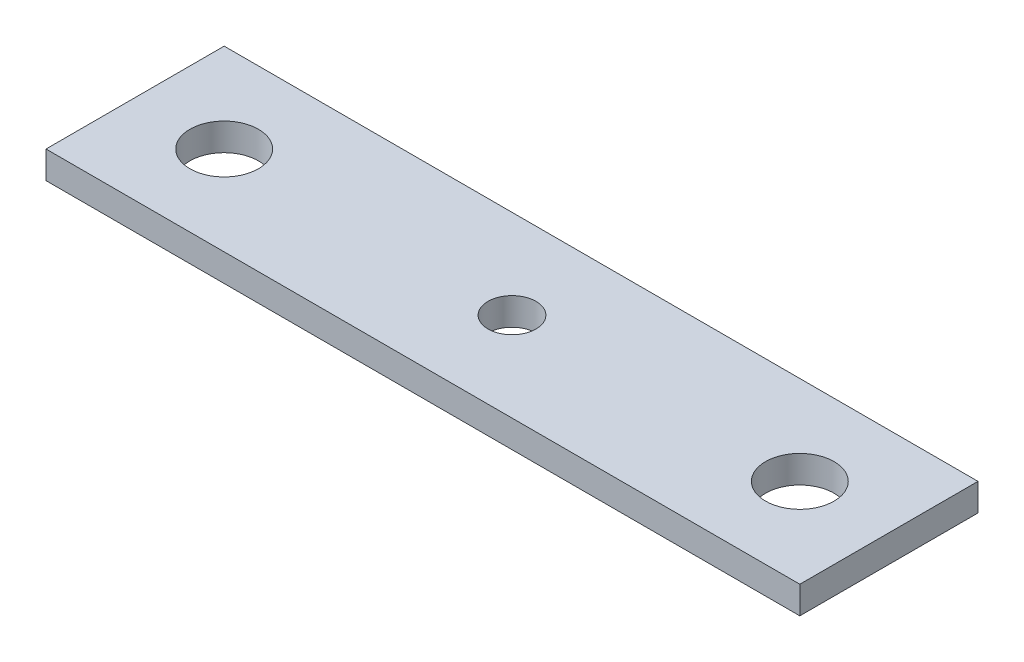
from build123d import *

# Parameters (mm, degrees)
SKETCH1_W           = 55
SKETCH1_H           = 13
SKETCH1_R           = 2.5
SKETCH1_R_2         = 1.75
BOSS_EXTRUDE1_DEPTH = 2


with BuildPart() as part:
    # Sketch1 → Boss-Extrude1 (new body)
    with BuildSketch(Plane(origin=(0, 0, 0), x_dir=(1, 0, 0), z_dir=(0, 1, 0))):
        Rectangle(SKETCH1_W, SKETCH1_H)
        with Locations(Location((-21, 0, 0), (0, 0, 270))):
            Circle(SKETCH1_R, mode=Mode.SUBTRACT)
        with Locations(Location((21, 0, 0), (0, 0, 270))):
            Circle(SKETCH1_R, mode=Mode.SUBTRACT)
        with Locations(Location((0, 0, 0), (0, 0, 270))):
            Circle(SKETCH1_R_2, mode=Mode.SUBTRACT)
    extrude(amount=BOSS_EXTRUDE1_DEPTH)


solid = part.part
